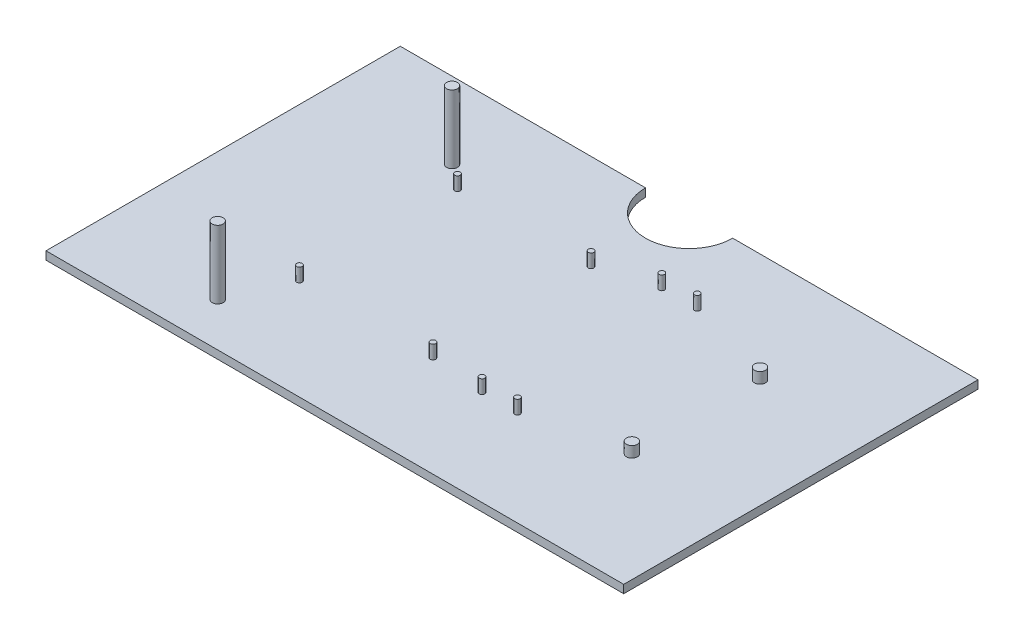
from build123d import *

# Parameters (mm, degrees)
SKETCH3_W           = 212
SKETCH3_H           = 130
BOSS_EXTRUDE1_DEPTH = 3
SKETCH4_R           = 2
BOSS_EXTRUDE2_DEPTH = 4
SKETCH5_R           = 1
BOSS_EXTRUDE3_DEPTH = 5
SKETCH6_R           = 2
BOSS_EXTRUDE4_DEPTH = 25
SKETCH7_R           = 1
BOSS_EXTRUDE5_DEPTH = 5
SKETCH8_R           = 16
CUT_EXTRUDE1_DEPTH  = 10


with BuildPart() as part:
    # Sketch3 → Boss-Extrude1 (new body)
    with BuildSketch(Plane(origin=(0, 0, 0), x_dir=(1, 0, 0), z_dir=(0, 1, 0))):
        Rectangle(SKETCH3_W, SKETCH3_H)
    extrude(amount=BOSS_EXTRUDE1_DEPTH)

    # Sketch4 → Boss-Extrude2 (add)
    with BuildSketch(Plane(origin=(0, 3, 0), x_dir=(1, 0, 0), z_dir=(0, 1, 0))):
        with Locations(Location((66, 25, 0), (0, 0, 270))):
            Circle(SKETCH4_R)
        with Locations(Location((66, -22, 0), (0, 0, 270))):
            Circle(SKETCH4_R)
    extrude(amount=BOSS_EXTRUDE2_DEPTH)

    # Sketch5 → Boss-Extrude3 (add)
    with BuildSketch(Plane(origin=(0, 3, 0), x_dir=(1, 0, 0), z_dir=(0, 1, 0))):
        with Locations(Location((-50, 30, 0), (0, 0, 270))):
            Circle(SKETCH5_R)
        with Locations(Location((-1, 30, 0), (0, 0, 270))):
            Circle(SKETCH5_R)
        with Locations(Location((-1, -28, 0), (0, 0, 270))):
            Circle(SKETCH5_R)
        with Locations(Location((-50, -28, 0), (0, 0, 270))):
            Circle(SKETCH5_R)
    extrude(amount=BOSS_EXTRUDE3_DEPTH)

    # Sketch6 → Boss-Extrude4 (add)
    with BuildSketch(Plane(origin=(0, 3, 0), x_dir=(1, 0, 0), z_dir=(0, 1, 0))):
        with Locations(Location((-59, -49, 0), (0, 0, 270))):
            Circle(SKETCH6_R)
        with Locations(Location((-59, 37, 0), (0, 0, 270))):
            Circle(SKETCH6_R)
    extrude(amount=BOSS_EXTRUDE4_DEPTH)

    # Sketch7 → Boss-Extrude5 (add)
    with BuildSketch(Plane(origin=(0, 3, 0), x_dir=(1, 0, 0), z_dir=(0, 1, 0))):
        with Locations(Location((19, 36, 0), (0, 0, 270))):
            Circle(SKETCH7_R)
        with Locations(Location((32, 36, 0), (0, 0, 270))):
            Circle(SKETCH7_R)
        with Locations(Location((32, -30, 0), (0, 0, 270))):
            Circle(SKETCH7_R)
        with Locations(Location((19, -30, 0), (0, 0, 270))):
            Circle(SKETCH7_R)
    extrude(amount=BOSS_EXTRUDE5_DEPTH)

    # Sketch8 → Cut-Extrude1 (cut)
    with BuildSketch(Plane(origin=(0, 3, 0), x_dir=(1, 0, 0), z_dir=(0, 1, 0))):
        with Locations((0, 65)):
            Circle(SKETCH8_R)
    extrude(amount=-CUT_EXTRUDE1_DEPTH, mode=Mode.SUBTRACT)


solid = part.part
